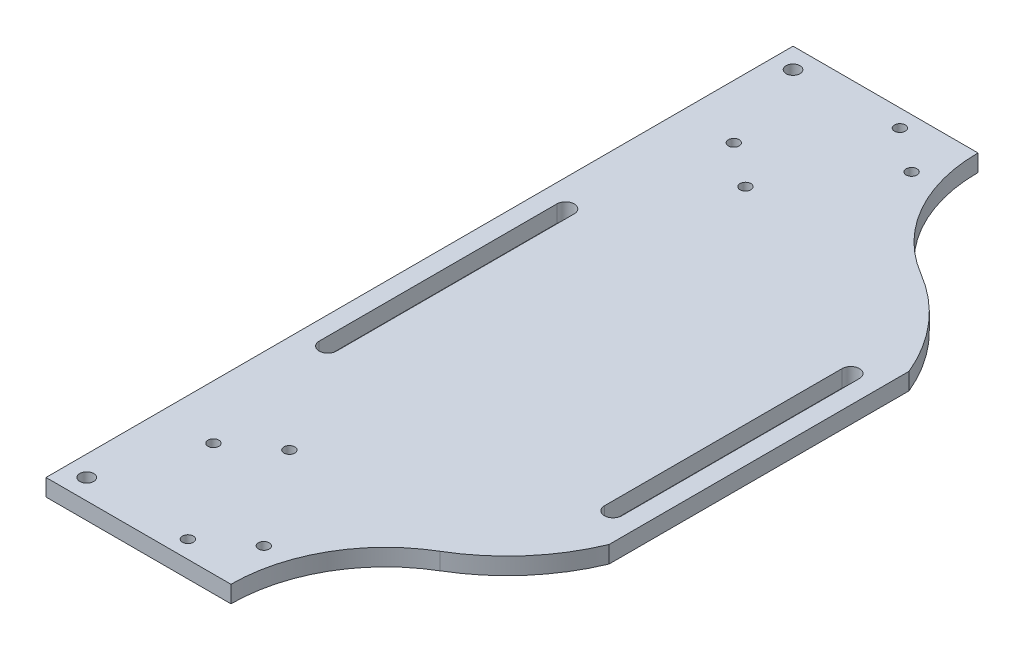
from build123d import *

# Parameters (mm, degrees)
SKETCH1_W           = 100
SKETCH1_H           = 220
SKETCH1_R           = 2.05
SKETCH1_R_2         = 1.6
BOSS_EXTRUDE1_DEPTH = 5
CUT_EXTRUDE1_DEPTH  = 10


with BuildPart() as part:
    # Sketch1 → Boss-Extrude1 (new body)
    with BuildSketch(Plane(origin=(0, 0, 0), x_dir=(1, 0, 0), z_dir=(0, 1, 0))):
        Rectangle(SKETCH1_W, SKETCH1_H)
        with Locations(Location((-44, 104, 0), (0, 0, 270))):
            Circle(SKETCH1_R, mode=Mode.SUBTRACT)
        with Locations(Location((-34.072831353, 76.618821882, 0), (0, 0, 270))):
            Circle(SKETCH1_R_2, mode=Mode.SUBTRACT)
        with Locations(Location((-0.472623192, 95.381178118, 0), (0, 0, 270))):
            Circle(SKETCH1_R_2, mode=Mode.SUBTRACT)
        with Locations(Location((-21.170351419, 67.157003264, 0), (0, 0, 270))):
            Circle(SKETCH1_R_2, mode=Mode.SUBTRACT)
        with Locations(Location((-13.375103126, 104.842996736, 0), (0, 0, 270))):
            Circle(SKETCH1_R_2, mode=Mode.SUBTRACT)
        with Locations(Location((-0.472623192, -95.381178118, 0), (0, 0, 90))):
            Circle(SKETCH1_R_2, mode=Mode.SUBTRACT)
        with Locations(Location((-21.170351419, -67.157003264, 0), (0, 0, 90))):
            Circle(SKETCH1_R_2, mode=Mode.SUBTRACT)
        with Locations(Location((-34.072831353, -76.618821882, 0), (0, 0, 90))):
            Circle(SKETCH1_R_2, mode=Mode.SUBTRACT)
        with Locations(Location((-44, -104, 0), (0, 0, 90))):
            Circle(SKETCH1_R, mode=Mode.SUBTRACT)
        with Locations(Location((-13.375103126, -104.842996736, 0), (0, 0, 90))):
            Circle(SKETCH1_R_2, mode=Mode.SUBTRACT)
        with BuildLine():
            Line((39.45, -35), (39.45, 35))
            ThreePointArc((39.45, 35), (42, 37.55), (44.55, 35))
            Line((44.55, 35), (44.55, -35))
            ThreePointArc((44.55, -35), (42, -37.55), (39.45, -35))
        make_face(mode=Mode.SUBTRACT)
        with BuildLine():
            Line((-39.45, -35), (-39.45, 35))
            ThreePointArc((-39.45, 35), (-42, 37.55), (-44.55, 35))
            Line((-44.55, 35), (-44.55, -35))
            ThreePointArc((-44.55, -35), (-42, -37.55), (-39.45, -35))
        make_face(mode=Mode.SUBTRACT)
    extrude(amount=BOSS_EXTRUDE1_DEPTH)

    # Sketch2 → Cut-Extrude1 (cut)
    with BuildSketch(Plane(origin=(0, 5, 0), x_dir=(1, 0, 0), z_dir=(0, 1, 0))):
        with BuildLine():
            Line((4.46621247, 110), (50, 110))
            Line((50, 110), (50, 44.175543471))
            ThreePointArc((50, 44.175543471), (40.575458137, 59.361991758), (26.838854749, 70.796847608))
            ThreePointArc((26.838854749, 70.796847608), (10.452936433, 87.431092849), (4.46621247, 110))
        make_face()
        with BuildLine():
            Line((50, -44.175543471), (50, -110))
            Line((50, -110), (4.46621247, -110))
            ThreePointArc((4.46621247, -110), (10.452936433, -87.431092849), (26.838854749, -70.796847608))
            ThreePointArc((26.838854749, -70.796847608), (40.575458137, -59.361991758), (50, -44.175543471))
        make_face()
    extrude(amount=-CUT_EXTRUDE1_DEPTH, mode=Mode.SUBTRACT)


solid = part.part
